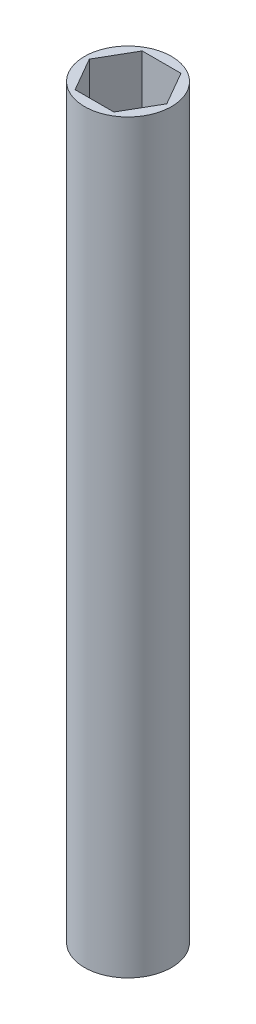
from build123d import *

# Parameters (mm, degrees)
SKETCH1_R           = 8.89
BOSS_EXTRUDE1_DEPTH = 152.4


with BuildPart() as part:
    # Sketch1 → Boss-Extrude1 (new body)
    with BuildSketch(Plane(origin=(0, 0, 0), x_dir=(1, 0, 0), z_dir=(0, 1, 0))):
        with Locations(Location((0, 0, 0), (0, 0, 90))):
            Circle(SKETCH1_R)
        Polygon((3.959468146, -6.858), (7.918936292, 0), (3.959468146, 6.858), (-3.959468146, 6.858), (-7.918936292, 0), (-3.959468146, -6.858), align=None, mode=Mode.SUBTRACT)
    extrude(amount=BOSS_EXTRUDE1_DEPTH)


solid = part.part
